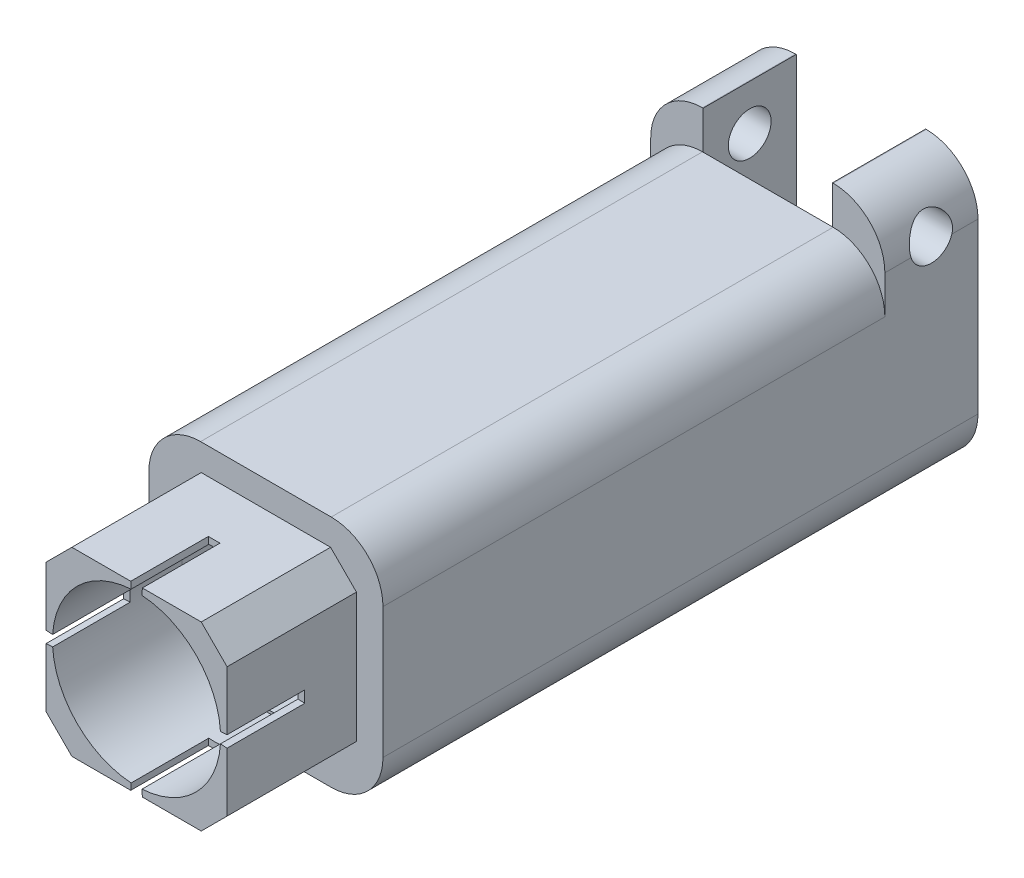
from build123d import *

# Parameters (mm, degrees)
BOSS_EXTRUDE1_DEPTH = 46
SKETCH3_R           = 6.5
BOSS_EXTRUDE2_DEPTH = 10
CUT_EXTRUDE7_DEPTH  = 6
CIRPATTERN1_COUNT   = 4
SKETCH12_R          = 6.5
CUT_EXTRUDE8_DEPTH  = 30
BOSS_EXTRUDE3_DEPTH = 7.2
SKETCH17_R          = 1.655
CUT_EXTRUDE10_DEPTH = 30
SKETCH18_R          = 5
CUT_EXTRUDE11_DEPTH = 6
BOSS_EXTRUDE4_DEPTH = 6
CIRPATTERN2_COUNT   = 36
SKETCH20_R          = 6.5
CUT_EXTRUDE12_DEPTH = 1.2
SKETCH21_W          = 10
SKETCH21_H          = 17.493725323
CUT_EXTRUDE13_DEPTH = 7.2


with BuildPart() as part:
    # Sketch1 → Boss-Extrude1 (new body)
    with BuildSketch(Plane.XY):
        with BuildLine():
            Line((-5.05, 9.05), (5.05, 9.05))
            ThreePointArc((5.05, 9.05), (7.878427125, 7.878427125), (9.05, 5.05))
            Line((9.05, 5.05), (9.05, -5.05))
            ThreePointArc((9.05, -5.05), (7.878427125, -7.878427125), (5.05, -9.05))
            Line((5.05, -9.05), (-5.05, -9.05))
            ThreePointArc((-5.05, -9.05), (-7.878427125, -7.878427125), (-9.05, -5.05))
            Line((-9.05, -5.05), (-9.05, 5.05))
            ThreePointArc((-9.05, 5.05), (-7.878427125, 7.878427125), (-5.05, 9.05))
        make_face()
    extrude(amount=BOSS_EXTRUDE1_DEPTH)

    # Sketch3 → Boss-Extrude2 (add)
    with BuildSketch(Plane.XY.offset(46)):
        Polygon((-5, -7), (5, -7), (7, -5), (7, 5), (5, 7), (-5, 7), (-7, 5), (-7, -5), align=None)
        Circle(SKETCH3_R, mode=Mode.SUBTRACT)
    extrude(amount=BOSS_EXTRUDE2_DEPTH)

    # Sketch11 → Cut-Extrude7 (cut)
    with BuildSketch(Plane.XY.offset(56)):
        Polygon((0, 0), (7, 0.45), (7, -0.45), align=None)
    cut_extrude7 = extrude(amount=-CUT_EXTRUDE7_DEPTH, mode=Mode.SUBTRACT)

    # CirPattern1: Cut-Extrude7 ×4 about axis
    cirpattern1_axis = Axis((0, 0, 56), (0, 0, -1))
    for i in range(1, CIRPATTERN1_COUNT):
        add(cut_extrude7.rotate(cirpattern1_axis, i * 360 / CIRPATTERN1_COUNT), mode=Mode.SUBTRACT)

    # Sketch12 → Cut-Extrude8 (cut)
    with BuildSketch(Plane.XY.offset(46)):
        with Locations((0, 0.192488852)):
            Circle(SKETCH12_R)
    extrude(amount=-CUT_EXTRUDE8_DEPTH, mode=Mode.SUBTRACT)

    # Sketch15 → Boss-Extrude3 (add)
    with BuildSketch(Plane.XY):
        with BuildLine():
            Line((-5.05, -9.05), (5.05, -9.05))
            ThreePointArc((5.05, -9.05), (7.878427125, -7.878427125), (9.05, -5.05))
            Line((9.05, -5.05), (9.05, 8))
            ThreePointArc((9.05, 8), (7.878427125, 10.828427125), (5.05, 12))
            Line((5.05, 12), (-5.05, 12))
            ThreePointArc((-5.05, 12), (-7.878427125, 10.828427125), (-9.05, 8))
            Line((-9.05, 8), (-9.05, -5.05))
            ThreePointArc((-9.05, -5.05), (-7.878427125, -7.878427125), (-5.05, -9.05))
        make_face()
    extrude(amount=BOSS_EXTRUDE3_DEPTH)

    # Sketch17 → Cut-Extrude10 (cut)
    with BuildSketch(Plane(origin=(9.05, 0, 0), x_dir=(0, 0, -1), z_dir=(1, 0, 0))):
        with Locations(Location((-3.6, 8.5, 0), (0, 0, 342.4153325))):
            Circle(SKETCH17_R)
    extrude(amount=-CUT_EXTRUDE10_DEPTH, mode=Mode.SUBTRACT)

    # Sketch18 → Cut-Extrude11 (cut)
    with BuildSketch(Plane.XY):
        Circle(SKETCH18_R)
    extrude(amount=CUT_EXTRUDE11_DEPTH, mode=Mode.SUBTRACT)

    # Sketch19 → Boss-Extrude4 (add)
    with BuildSketch(Plane.XY):
        with BuildLine():
            Line((-0.5, 4.974937186), (0, 4.455493066))
            Line((0, 4.455493066), (0.5, 4.974937186))
            ThreePointArc((0.5, 4.974937186), (0, 5.474937186), (-0.5, 4.974937186))
        make_face()
    boss_extrude4 = extrude(amount=BOSS_EXTRUDE4_DEPTH)

    # CirPattern2: Boss-Extrude4 ×36 about axis
    cirpattern2_axis = Axis((0, 0, 0), (0, 0, 1))
    for i in range(1, CIRPATTERN2_COUNT):
        add(boss_extrude4.rotate(cirpattern2_axis, i * 360 / CIRPATTERN2_COUNT))

    # Sketch20 → Cut-Extrude12 (cut)
    with BuildSketch(Plane(origin=(0, 0, 6), x_dir=(-1, 0, 0), z_dir=(0, 0, -1))):
        with Locations(Location((0, 0, 0), (0, 0, 0.848400141))):
            Circle(SKETCH20_R)
    extrude(amount=-CUT_EXTRUDE12_DEPTH, mode=Mode.SUBTRACT)

    # Sketch21 → Cut-Extrude13 (cut)
    with BuildSketch(Plane.XY):
        with Locations((0, 8.746862661)):
            Rectangle(SKETCH21_W, SKETCH21_H)
    extrude(amount=CUT_EXTRUDE13_DEPTH, mode=Mode.SUBTRACT)


solid = part.part
